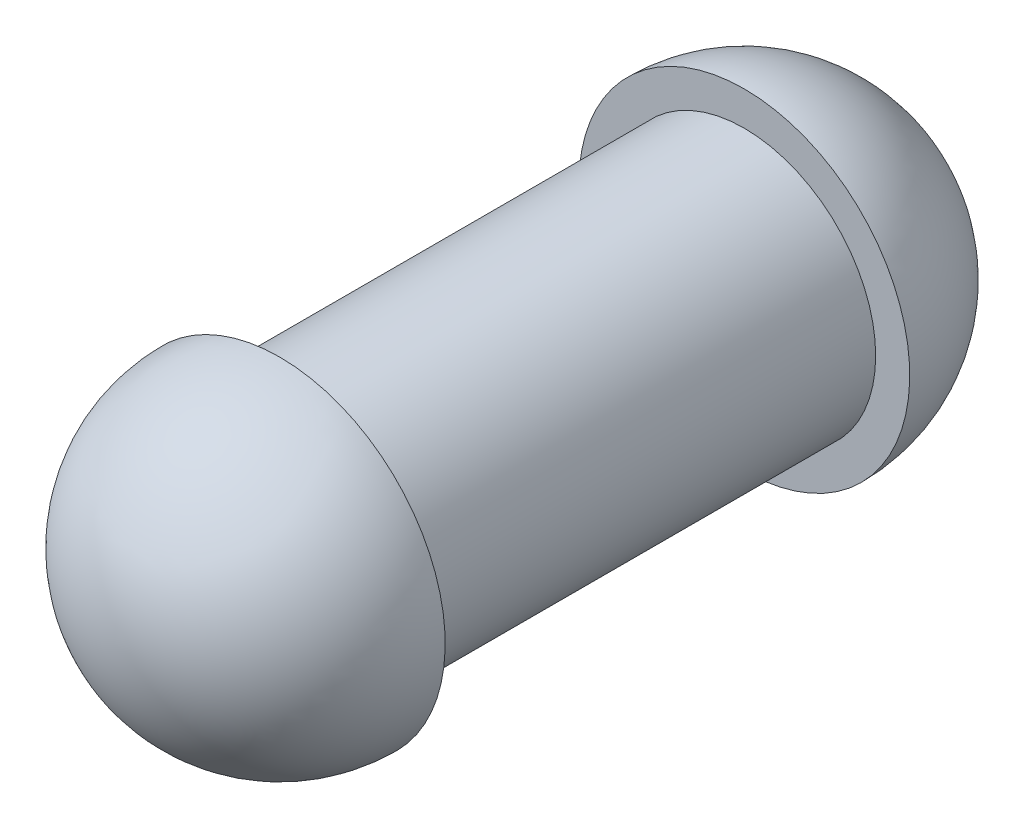
from build123d import *

# Parameters (mm, degrees)
SKETCH1_R           = 20.65
BOSS_EXTRUDE1_DEPTH = 36.5


with BuildPart() as part:
    # Sketch1 → Boss-Extrude1 (new, symmetric)
    with BuildSketch(Plane.XY):
        Circle(SKETCH1_R)
    extrude(amount=BOSS_EXTRUDE1_DEPTH, both=True)

    # Sketch2 → Revolve1 (revolve)
    with BuildSketch(Plane(origin=(0, 0, 0), x_dir=(0, 0, -1), z_dir=(1, 0, 0))):
        with BuildLine():
            Line((-62.5, 0), (-36.5, 0))
            Line((-36.5, 0), (-36.5, 26))
            ThreePointArc((-36.5, 26), (-54.884776311, 18.384776311), (-62.5, 0))
        make_face()
    revolve(axis=Axis((0, 0, 0), (0, 0, 1)))

    # Mirror1: part across plane


with BuildPart() as part_1:
    add(part.part)
    add(part.part.mirror(Plane.XY))


solid = part_1.part
